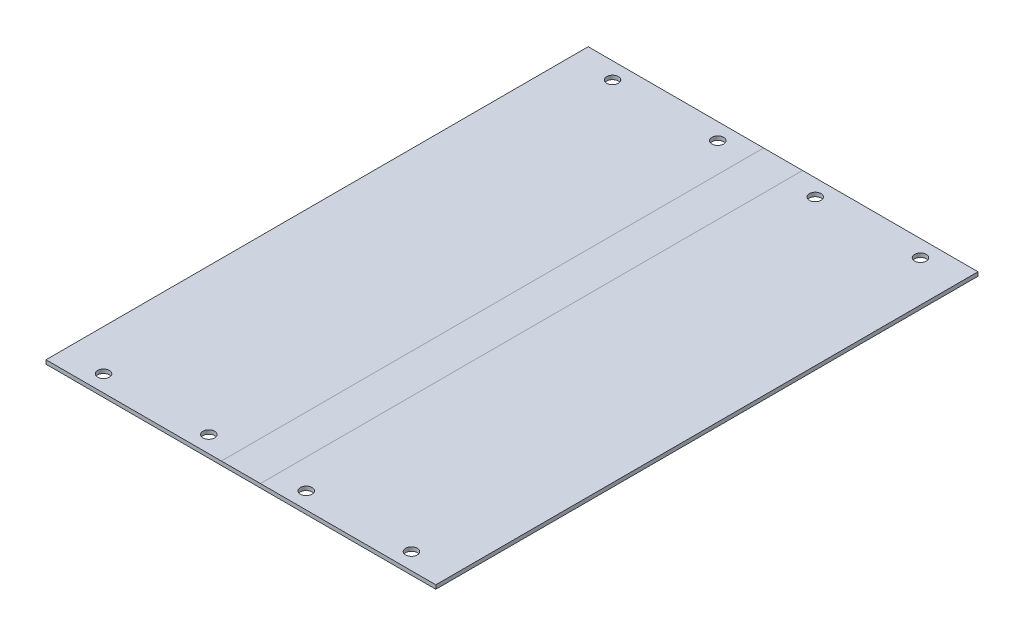
from build123d import *

# Parameters (mm, degrees)
SKETCH_1_W          = 100
SKETCH_1_H          = 139.1
EXTRUDE_1_DEPTH     = 1
SKETCH_2_R          = 1.5
CUT_EXTRUDE_1_DEPTH = 1


with BuildPart() as part:
    # 草圖1 → 填料-伸長1 (new body)
    with BuildSketch(Plane(origin=(0, 0, 0), x_dir=(1, 0, 0), z_dir=(0, 1, 0))):
        Rectangle(SKETCH_1_W, SKETCH_1_H)
    extrude(amount=EXTRUDE_1_DEPTH)

    # 草圖2 → 除料-伸長1 (cut)
    with BuildSketch(Plane(origin=(0, 1, 0), x_dir=(1, 0, 0), z_dir=(0, 1, 0))):
        with Locations(Location((-12.5, 65.29, 0), (0, 0, 270))):
            Circle(SKETCH_2_R)
        with Locations(Location((-39.5, 65.29, 0), (0, 0, 270))):
            Circle(SKETCH_2_R)
        with Locations(Location((39.5, 65.29, 0), (0, 0, 90))):
            Circle(SKETCH_2_R)
        with Locations(Location((12.5, 65.29, 0), (0, 0, 90))):
            Circle(SKETCH_2_R)
        with Locations(Location((39.5, -65.29, 0), (0, 0, 270))):
            Circle(SKETCH_2_R)
        with Locations(Location((12.5, -65.29, 0), (0, 0, 270))):
            Circle(SKETCH_2_R)
        with Locations(Location((-12.5, -65.29, 0), (0, 0, 90))):
            Circle(SKETCH_2_R)
        with Locations(Location((-39.5, -65.29, 0), (0, 0, 90))):
            Circle(SKETCH_2_R)
    extrude(amount=-CUT_EXTRUDE_1_DEPTH, mode=Mode.SUBTRACT)


solid = part.part
